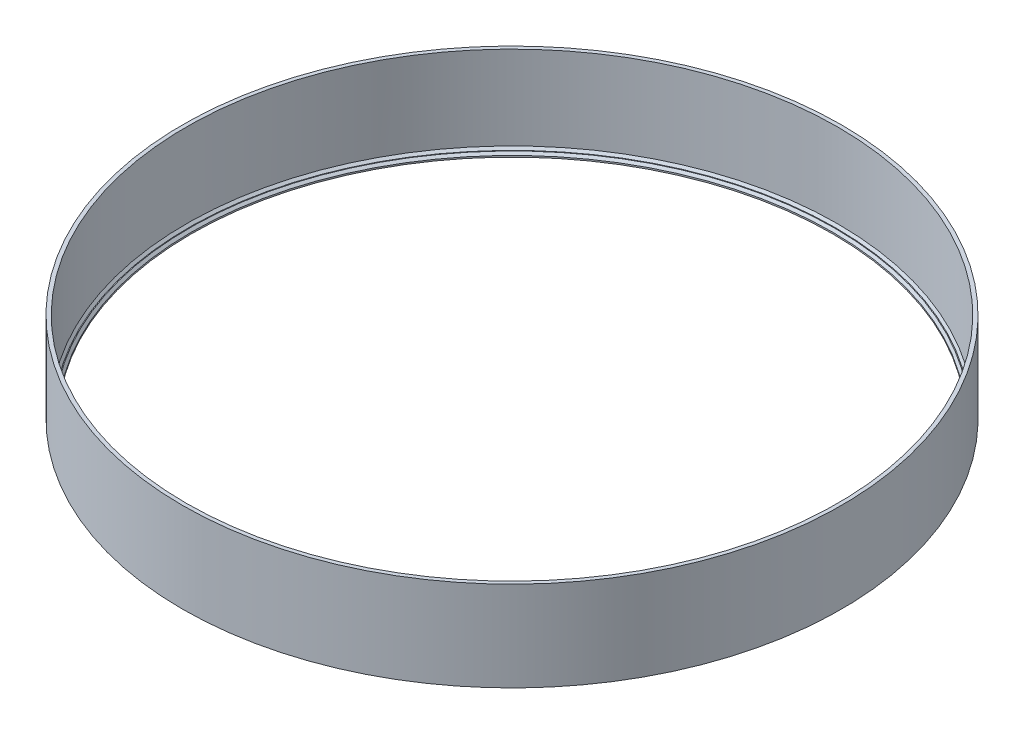
from build123d import *

# Parameters (mm, degrees)
CROQUIS1_R              = 44
CROQUIS1_R_2            = 43.5
SALIENTE_EXTRUIR1_DEPTH = 12
CROQUIS2_R              = 44
CROQUIS2_R_2            = 42.8
SALIENTE_EXTRUIR2_DEPTH = 0.5
CHAFL_N1_SIZE           = 0.3


with BuildPart() as part:
    # Croquis1 → Saliente-Extruir1 (new body)
    with BuildSketch(Plane(origin=(0, 0, 0), x_dir=(1, 0, 0), z_dir=(0, 1, 0))):
        with Locations(Location((0, 0, 0), (0, 0, 270))):
            Circle(CROQUIS1_R)
        with Locations(Location((0, 0, 0), (0, 0, 270))):
            Circle(CROQUIS1_R_2, mode=Mode.SUBTRACT)
    extrude(amount=SALIENTE_EXTRUIR1_DEPTH)

    # Croquis2 → Saliente-Extruir2 (add)
    with BuildSketch(Plane.XZ):
        with Locations(Location((0, 0, 0), (0, 0, 90))):
            Circle(CROQUIS2_R)
        with Locations(Location((0, 0, 0), (0, 0, 270))):
            Circle(CROQUIS2_R_2, mode=Mode.SUBTRACT)
    extrude(amount=-SALIENTE_EXTRUIR2_DEPTH)

    # Chaflán1
    chafl_n1_edges = [part.edges().sort_by_distance(p)[0] for p in [
        (0, 0.5, 42.8),
        (0, 0.5, -43.5),
    ]]
    chamfer(chafl_n1_edges, length=CHAFL_N1_SIZE)


solid = part.part
